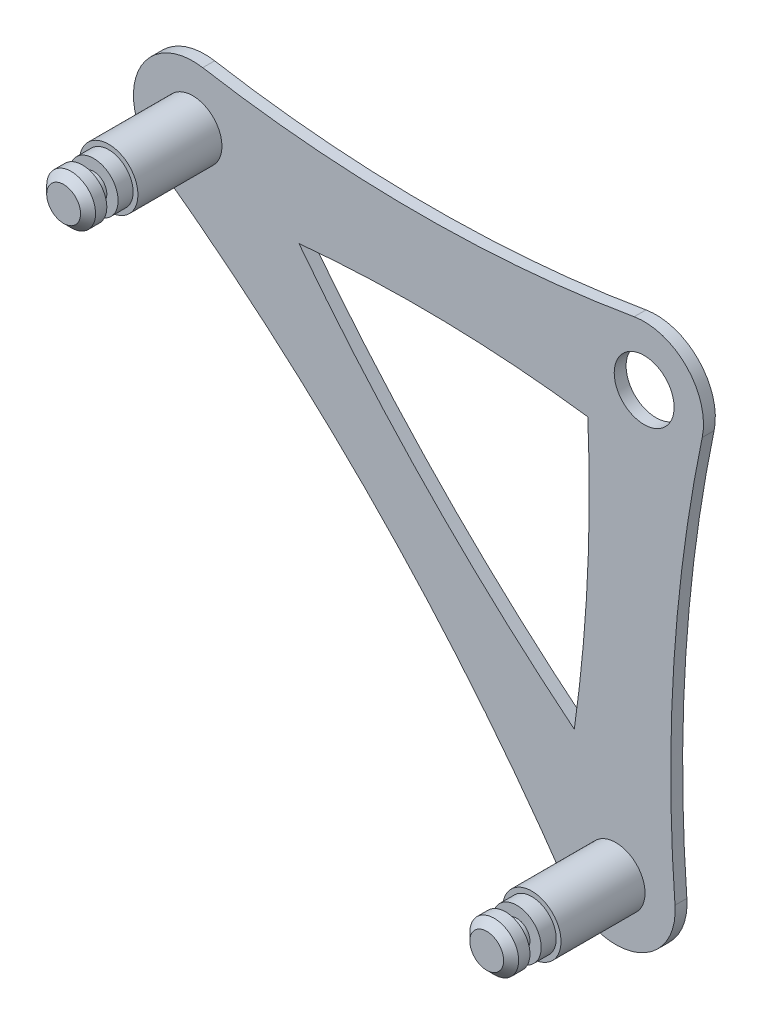
from build123d import *

# Parameters (mm, degrees)
ESQUISSE1_R             = 7.89
ESQUISSE1_R_2           = 3.885
ESQUISSE1_R_3           = 3.985
BOSS_EXTRU_1_DEPTH      = 1.58
BOSS_EXTRU_2_START      = 1.58
ESQUISSE1_3_R           = 3.885
BOSS_EXTRU_2_DEPTH      = 11.18
ESQUISSE2_R             = 3.25
BOSS_EXTRU_3_DEPTH      = 6
ENL_V_START             = -4
ESQUISSE3_R             = 3.25
ESQUISSE3_R_2           = 1.75
ENL_V_MAT_EXTRU_1_DEPTH = 1.5
CHANFREIN1_SIZE         = 1


with BuildPart() as part:
    # Esquisse1 → Boss.-Extru.1 (new body)
    # profile 1 of 11: a face of its own
    with BuildSketch(Plane(origin=(0, 0, 0), x_dir=(0, 1, 0), z_dir=(0, 0, 1))):
        with Locations((-57.907596038, 3.76712371)):
            Circle(ESQUISSE1_R)
        with Locations((-57.907596038, 3.76712371)):
            Circle(ESQUISSE1_R_2, mode=Mode.SUBTRACT)
    # profile 2 of 11: a face of its own
    with BuildSketch(Plane(origin=(0, 0, 0), x_dir=(0, 1, 0), z_dir=(0, 0, 1))):
        with Locations((-57.907596038, 3.76712371)):
            Circle(ESQUISSE1_R_2)
    # profile 3 of 11: a face of its own
    with BuildSketch(Plane(origin=(0, 0, 0), x_dir=(0, 1, 0), z_dir=(0, 0, 1))):
        with BuildLine():
            ThreePointArc((-56.301538768, 11.491933095), (-51.786979572, 8.746094895), (-50.017596038, 3.76712371))
            ThreePointArc((-50.017596038, 3.76712371), (-50.400051579, 1.340423031), (-51.510340319, -0.851016528))
            ThreePointArc((-51.510340319, -0.851016528), (-47.696280505, 4.277310952), (-43.738103365, 9.295241675))
            ThreePointArc((-43.738103365, 9.295241675), (-50.037335941, 10.293415373), (-56.301538768, 11.491933095))
        make_face()
    # profile 4 of 11: a face of its own
    with BuildSketch(Plane(origin=(0, 0, 0), x_dir=(0, 1, 0), z_dir=(0, 0, 1))):
        with BuildLine():
            ThreePointArc((-62.343020281, 10.292390891), (-59.444168438, 11.506054208), (-56.301538768, 11.491933095))
            ThreePointArc((-56.301538768, 11.491933095), (-50.037335941, 10.293415373), (-43.738103365, 9.295241675))
            ThreePointArc((-43.738103365, 9.295241675), (-25.983312523, 28.716933044), (-6.082429339, 45.932900691))
            ThreePointArc((-6.082429339, 45.932900691), (-6.808122629, 52.346571885), (-7.776764583, 58.728071842))
            ThreePointArc((-7.776764583, 58.728071842), (-7.686126552, 61.842009718), (-6.39725572, 64.678140238))
            ThreePointArc((-6.39725572, 64.678140238), (-31.994708958, 35.041699087), (-62.343020281, 10.292390891))
        make_face()
    # profile 5 of 11: a face of its own
    with BuildSketch(Plane(origin=(0, 0, 0), x_dir=(0, 1, 0), z_dir=(0, 0, 1))):
        with BuildLine():
            ThreePointArc((-7.776764583, 58.728071842), (-6.808122629, 52.346571885), (-6.082429339, 45.932900691))
            ThreePointArc((-6.082429339, 45.932900691), (-0.878320654, 49.809662788), (4.435424243, 53.534732819))
            ThreePointArc((4.435424243, 53.534732819), (-3.087690297, 52.799265283), (-7.776764583, 58.728071842))
        make_face()
    # profile 6 of 11: a face of its own
    with BuildSketch(Plane(origin=(0, 0, 0), x_dir=(0, 1, 0), z_dir=(0, 0, 1))):
        with Locations((0, 60.06)):
            Circle(ESQUISSE1_R)
        with Locations((0, 60.06)):
            Circle(ESQUISSE1_R_2, mode=Mode.SUBTRACT)
    # profile 7 of 11: a face of its own
    with BuildSketch(Plane(origin=(0, 0, 0), x_dir=(0, 1, 0), z_dir=(0, 0, 1))):
        with Locations((0, 60.06)):
            Circle(ESQUISSE1_R_2)
    # profile 8 of 11: a face of its own
    with BuildSketch(Plane(origin=(0, 0, 0), x_dir=(0, 1, 0), z_dir=(0, 0, 1))):
        with BuildLine():
            ThreePointArc((-43.738103365, 9.295241675), (-47.696280505, 4.277310952), (-51.510340319, -0.851016528))
            ThreePointArc((-51.510340319, -0.851016528), (-54.053844003, -3.117692573), (-57.315900013, -4.100658431))
            ThreePointArc((-57.315900013, -4.100658431), (-29.333901967, -3.959332501), (-1.606057271, -7.724809386))
            ThreePointArc((-1.606057271, -7.724809386), (-6.520388042, -4.442593812), (-7.776764583, 1.331928158))
            ThreePointArc((-7.776764583, 1.331928158), (-7.278629827, 4.40977224), (-6.837025839, 7.496234348))
            ThreePointArc((-6.837025839, 7.496234348), (-25.32919367, 7.541846284), (-43.738103365, 9.295241675))
        make_face()
    # profile 9 of 11: a face of its own
    with BuildSketch(Plane(origin=(0, 0, 0), x_dir=(0, 1, 0), z_dir=(0, 0, 1))):
        with BuildLine():
            ThreePointArc((4.435424243, 53.534732819), (-0.878320654, 49.809662788), (-6.082429339, 45.932900691))
            ThreePointArc((-6.082429339, 45.932900691), (-5.369716255, 26.693168194), (-6.837025839, 7.496234348))
            ThreePointArc((-6.837025839, 7.496234348), (-3.712908005, 7.657586059), (-0.591696025, 7.867782141))
            ThreePointArc((-0.591696025, 7.867782141), (4.85650588, 6.218235331), (7.776764583, 1.331928158))
            ThreePointArc((7.776764583, 1.331928158), (5.336964728, 30.03), (7.776764583, 58.728071842))
            ThreePointArc((7.776764583, 58.728071842), (6.635290614, 55.790922996), (4.435424243, 53.534732819))
        make_face()
    # profile 10 of 11: a face of its own
    with BuildSketch(Plane(origin=(0, 0, 0), x_dir=(0, 1, 0), z_dir=(0, 0, 1))):
        with BuildLine():
            ThreePointArc((-0.591696025, 7.867782141), (-3.712908005, 7.657586059), (-6.837025839, 7.496234348))
            ThreePointArc((-6.837025839, 7.496234348), (-7.278629827, 4.40977224), (-7.776764583, 1.331928158))
            ThreePointArc((-7.776764583, 1.331928158), (-5.309155306, 5.836520362), (-0.591696025, 7.867782141))
        make_face()
    # profile 11 of 11: a face of its own
    with BuildSketch(Plane(origin=(0, 0, 0), x_dir=(0, 1, 0), z_dir=(0, 0, 1))):
        Circle(ESQUISSE1_R)
        with Locations(Location((0, 0, 0), (0, 0, 90))):
            Circle(ESQUISSE1_R_3, mode=Mode.SUBTRACT)
    extrude(amount=BOSS_EXTRU_1_DEPTH)

    # Esquisse1<3> → Boss.-Extru.2 (add)
    with BuildSketch(Plane(origin=(0, 0, 0), x_dir=(0, 1, 0), z_dir=(0, 0, 1)).offset(BOSS_EXTRU_2_START)):
        with Locations(Location((0, 60.06, 0), (0, 0, 90))):
            Circle(ESQUISSE1_3_R)
        with Locations(Location((-57.907596038, 3.76712371, 0), (0, 0, 90))):
            Circle(ESQUISSE1_3_R)
    extrude(amount=BOSS_EXTRU_2_DEPTH)

    # Esquisse2 → Boss.-Extru.3 (add)
    with BuildSketch(Plane.XY.offset(12.76)):
        with Locations((-3.76712371, -57.907596038)):
            Circle(ESQUISSE2_R)
        with Locations((-60.06, 0)):
            Circle(ESQUISSE2_R)
    extrude(amount=BOSS_EXTRU_3_DEPTH)

    # Esquisse3 → Enlèv. mat.-Extru.1 (cut)
    # profile 1 of 2: a face of its own
    with BuildSketch(Plane.XY.offset(18.76).offset(ENL_V_START)):
        with Locations((-60.06, 0)):
            Circle(ESQUISSE3_R)
        with Locations((-60.06, 0)):
            Circle(ESQUISSE3_R_2, mode=Mode.SUBTRACT)
    # profile 2 of 2: a face of its own
    with BuildSketch(Plane.XY.offset(18.76).offset(ENL_V_START)):
        with Locations((-3.76712371, -57.907596038)):
            Circle(ESQUISSE3_R)
        with Locations((-3.76712371, -57.907596038)):
            Circle(ESQUISSE3_R_2, mode=Mode.SUBTRACT)
    extrude(amount=ENL_V_MAT_EXTRU_1_DEPTH, mode=Mode.SUBTRACT)

    # Chanfrein1
    chanfrein1_edges = [part.edges().sort_by_distance(p)[0] for p in [
        (-7.01712371, -57.907596038, 18.76),
        (-63.31, 0, 18.76),
    ]]
    chamfer(chanfrein1_edges, length=CHANFREIN1_SIZE)


solid = part.part
